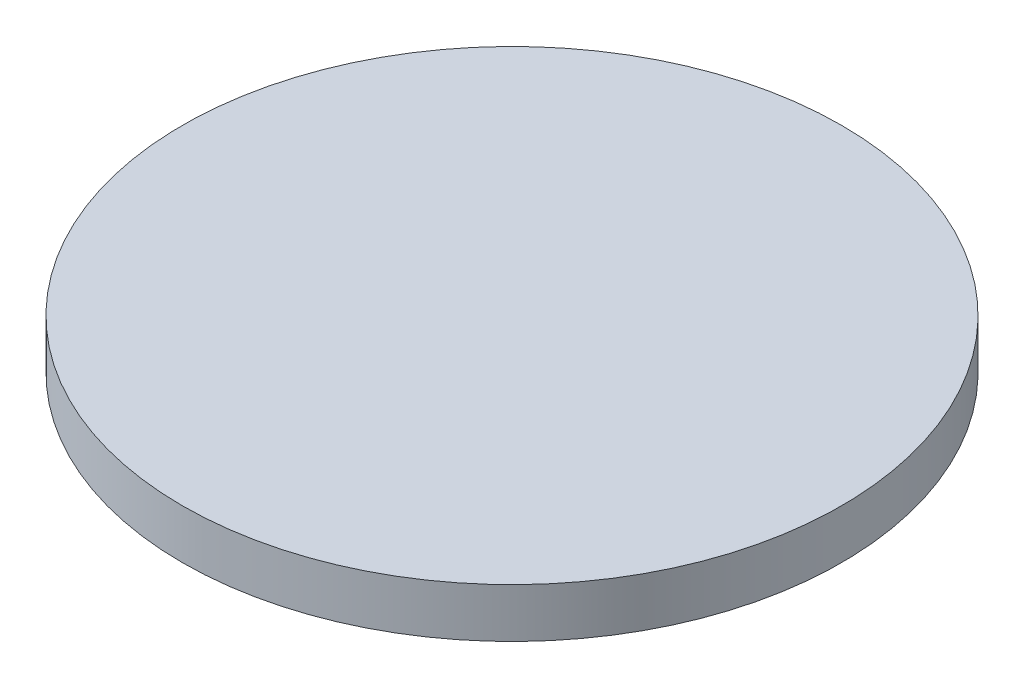
from build123d import *

# Parameters (mm, degrees)
SKETCH1_R           = 20.32
BOSS_EXTRUDE1_DEPTH = 3.03784


with BuildPart() as part:
    # Sketch1 → Boss-Extrude1 (new body)
    with BuildSketch(Plane(origin=(0, 0, 0), x_dir=(1, 0, 0), z_dir=(0, 1, 0))):
        with Locations(Location((0, 0, 0), (0, 0, 270))):
            Circle(SKETCH1_R)
    extrude(amount=BOSS_EXTRUDE1_DEPTH)


solid = part.part
